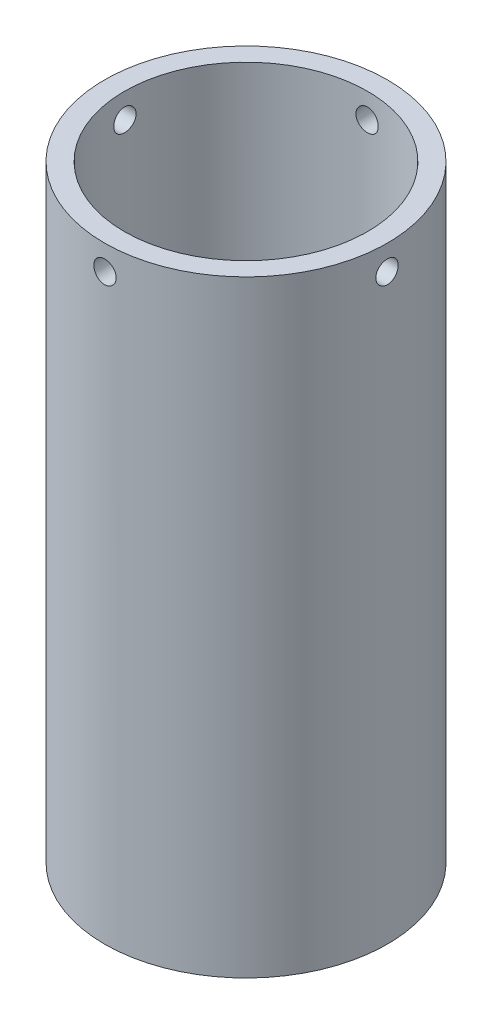
from build123d import *

# Parameters (mm, degrees)
SKETCH1_R           = 28.5
SKETCH1_R_2         = 21
BOSS_EXTRUDE1_DEPTH = 60.675
SKETCH2_R           = 2.25
CUT_EXTRUDE1_DEPTH  = 73.841990809
CIRPATTERN1_COUNT   = 4
CUT_EXTRUDE4_START  = -1
SKETCH5_R           = 28.5
CUT_EXTRUDE4_DEPTH  = 1
SKETCH3_R           = 2.25
CUT_EXTRUDE2_DEPTH  = 6.5
SKETCH4_R           = 24.5
CUT_EXTRUDE3_DEPTH  = 109.85
BOSS_EXTRUDE2_START = 2
SKETCH7_R           = 28.5
SKETCH7_R_2         = 2.25
SKETCH7_R_3         = 21
BOSS_EXTRUDE2_DEPTH = 2


with BuildPart() as part:
    # Sketch1 → Boss-Extrude1 (new, symmetric)
    with BuildSketch(Plane(origin=(0, 0, 0), x_dir=(1, 0, 0), z_dir=(0, 1, 0))):
        with Locations(Location((0, 0, 0), (0, 0, 270))):
            Circle(SKETCH1_R)
        with Locations(Location((0, 0, 0), (0, 0, 270))):
            Circle(SKETCH1_R_2, mode=Mode.SUBTRACT)
    extrude(amount=BOSS_EXTRUDE1_DEPTH, both=True)

    # Sketch2 → Cut-Extrude1 (cut, through all)
    with BuildSketch(Plane.XY):
        with Locations(Location((0, 55.675, 0), (0, 0, 90))):
            Circle(SKETCH2_R)
    cut_extrude1 = extrude(amount=-CUT_EXTRUDE1_DEPTH, mode=Mode.SUBTRACT)

    # CirPattern1: Cut-Extrude1 ×4 about axis
    cirpattern1_axis = Axis((0, 60.675, 0), (0, -1, 0))
    for i in range(1, CIRPATTERN1_COUNT):
        add(cut_extrude1.rotate(cirpattern1_axis, i * 360 / CIRPATTERN1_COUNT), mode=Mode.SUBTRACT)

    # Sketch5 → Cut-Extrude4 (cut)
    with BuildSketch(Plane.XZ.offset(60.675).offset(CUT_EXTRUDE4_START)):
        with Locations(Location((0, 0, 0), (0, 0, 270))):
            Circle(SKETCH5_R)
    extrude(amount=CUT_EXTRUDE4_DEPTH, mode=Mode.SUBTRACT)

    # Sketch3 → Cut-Extrude2 (cut)
    with BuildSketch(Plane.XZ.offset(59.675)):
        with Locations(Location((0, -24.75, 0), (0, 0, 270))):
            Circle(SKETCH3_R)
        with Locations(Location((0, 24.75, 0), (0, 0, 270))):
            Circle(SKETCH3_R)
        with Locations(Location((17.500892834, 17.500892834, 0), (0, 0, 270))):
            Circle(SKETCH3_R)
        with Locations(Location((24.75, 0, 0), (0, 0, 270))):
            Circle(SKETCH3_R)
        with Locations(Location((17.500892834, -17.500892834, 0), (0, 0, 270))):
            Circle(SKETCH3_R)
        with Locations(Location((-17.500892834, -17.500892834, 0), (0, 0, 270))):
            Circle(SKETCH3_R)
        with Locations(Location((-24.75, 0, 0), (0, 0, 270))):
            Circle(SKETCH3_R)
        with Locations(Location((-17.500892834, 17.500892834, 0), (0, 0, 270))):
            Circle(SKETCH3_R)
    extrude(amount=-CUT_EXTRUDE2_DEPTH, mode=Mode.SUBTRACT)

    # Sketch4 → Cut-Extrude3 (cut)
    with BuildSketch(Plane(origin=(0, 60.675, 0), x_dir=(1, 0, 0), z_dir=(0, 1, 0))):
        with Locations(Location((0, 0, 0), (0, 0, 270))):
            Circle(SKETCH4_R)
    extrude(amount=-CUT_EXTRUDE3_DEPTH, mode=Mode.SUBTRACT)

    # Sketch7 → Boss-Extrude2 (add)
    with BuildSketch(Plane.XZ.offset(59.675).offset(BOSS_EXTRUDE2_START)):
        with Locations(Location((0, 0, 0), (0, 0, 270))):
            Circle(SKETCH7_R)
        with Locations(Location((-17.500892834, -17.500892834, 0), (0, 0, 270))):
            Circle(SKETCH7_R_2, mode=Mode.SUBTRACT)
        with Locations(Location((0, -24.75, 0), (0, 0, 270))):
            Circle(SKETCH7_R_2, mode=Mode.SUBTRACT)
        with Locations(Location((17.500892834, -17.500892834, 0), (0, 0, 270))):
            Circle(SKETCH7_R_2, mode=Mode.SUBTRACT)
        with Locations(Location((24.75, 0, 0), (0, 0, 270))):
            Circle(SKETCH7_R_2, mode=Mode.SUBTRACT)
        with Locations(Location((-24.75, 0, 0), (0, 0, 270))):
            Circle(SKETCH7_R_2, mode=Mode.SUBTRACT)
        with Locations(Location((-17.500892834, 17.500892834, 0), (0, 0, 270))):
            Circle(SKETCH7_R_2, mode=Mode.SUBTRACT)
        with Locations(Location((0, 24.75, 0), (0, 0, 270))):
            Circle(SKETCH7_R_2, mode=Mode.SUBTRACT)
        with Locations(Location((17.500892834, 17.500892834, 0), (0, 0, 270))):
            Circle(SKETCH7_R_2, mode=Mode.SUBTRACT)
        with Locations(Location((0, 0, 0), (0, 0, 270))):
            Circle(SKETCH7_R_3, mode=Mode.SUBTRACT)
    extrude(amount=-BOSS_EXTRUDE2_DEPTH)


solid = part.part
